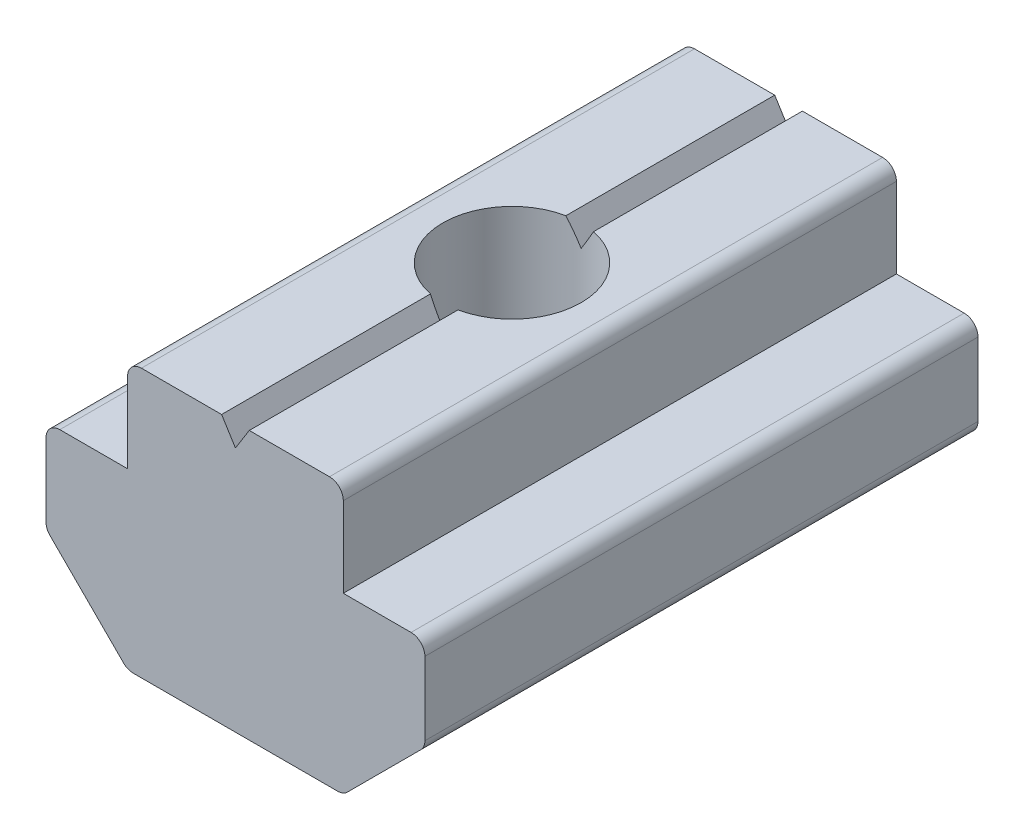
from build123d import *

# Parameters (mm, degrees)
EXTRUDE_1_DEPTH        = 10
HOLE_WIZARD_M6_1_D     = 5
HOLE_WIZARD_M6_1_DEPTH = 15
HOLE_WIZARD_M6_1_TIP   = 1.502151548


with BuildPart() as part:
    # 草图1 → 凸台-拉伸1 (new, symmetric)
    with BuildSketch(Plane.XY):
        with BuildLine():
            Line((-0.162211674, 0.146446609), (-2.819318456, 2.803553391))
            ThreePointArc((-2.819318456, 2.803553391), (-2.927704831, 2.965765065), (-2.965765065, 3.157106781))
            Line((-2.965765065, 3.157106781), (-2.965765065, 5.8))
            ThreePointArc((-2.965765065, 5.8), (-2.819318456, 6.153553391), (-2.465765065, 6.3))
            Line((-2.465765065, 6.3), (-0.015765065, 6.3))
            Line((-0.015765065, 6.3), (-0.015765065, 9.2))
            ThreePointArc((-0.015765065, 9.2), (0.130681544, 9.553553391), (0.484234935, 9.7))
            Line((0.484234935, 9.7), (3.384234935, 9.7))
            Line((3.384234935, 9.7), (3.884234935, 8.9))
            Line((3.884234935, 8.9), (4.384234935, 9.7))
            Line((4.384234935, 9.7), (7.284234935, 9.7))
            ThreePointArc((7.284234935, 9.7), (7.637788326, 9.553553391), (7.784234935, 9.2))
            Line((7.784234935, 9.2), (7.784234935, 6.3))
            Line((7.784234935, 6.3), (10.234234935, 6.3))
            ThreePointArc((10.234234935, 6.3), (10.587788326, 6.153553391), (10.734234935, 5.8))
            Line((10.734234935, 5.8), (10.734234935, 3.157106781))
            ThreePointArc((10.734234935, 3.157106781), (10.696174701, 2.965765065), (10.587788326, 2.803553391))
            Line((10.587788326, 2.803553391), (7.930681544, 0.146446609))
            ThreePointArc((7.930681544, 0.146446609), (7.76846987, 0.038060234), (7.577128154, 0))
            Line((7.577128154, 0), (0.191341716, 0))
            ThreePointArc((0.191341716, 0), (0, 0.038060234), (-0.162211674, 0.146446609))
        make_face()
    extrude(amount=EXTRUDE_1_DEPTH, both=True)

    # M6 螺纹孔1
    with Locations(Plane(origin=(3.884234935, 0, 0), x_dir=(-1, 0, 0), z_dir=(0, -1, 0))):
        with Locations((0, 0)):
            Hole(HOLE_WIZARD_M6_1_D / 2, depth=HOLE_WIZARD_M6_1_DEPTH)
            with Locations((0, 0, -(HOLE_WIZARD_M6_1_DEPTH + HOLE_WIZARD_M6_1_TIP / 2))):  # 118° drill point
                Cone(0, HOLE_WIZARD_M6_1_D / 2, HOLE_WIZARD_M6_1_TIP, mode=Mode.SUBTRACT)


solid = part.part
